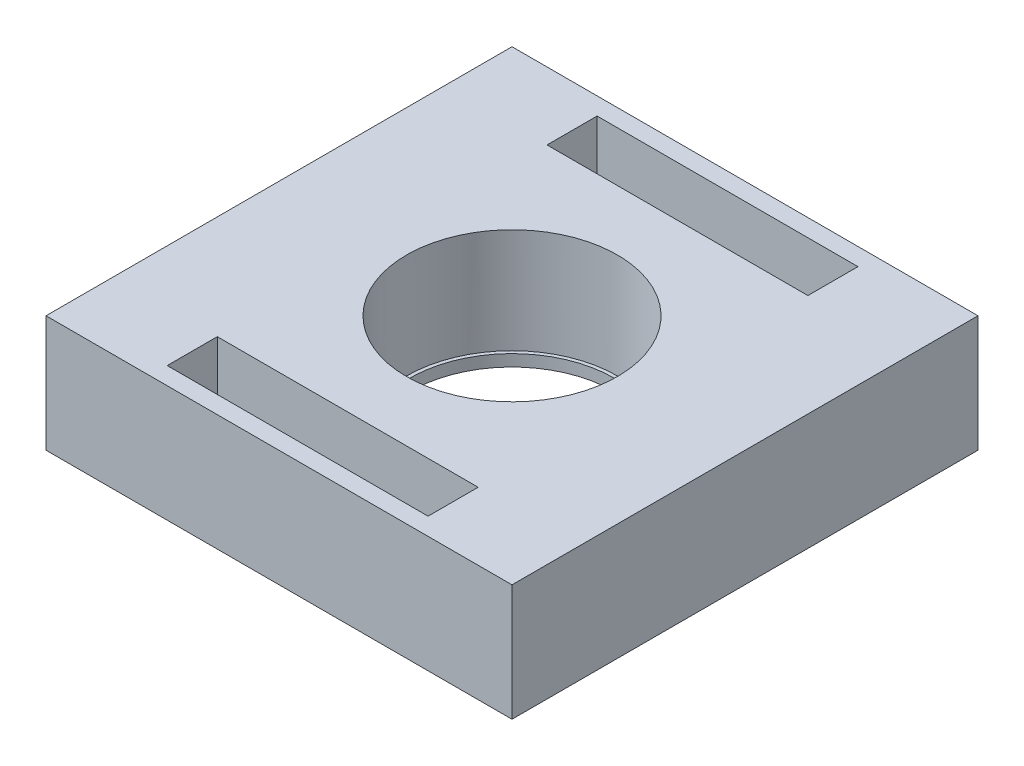
from build123d import *

# Parameters (mm, degrees)
SKETCH1_W           = 40.015172748
SKETCH1_H           = 40.015172748
BOSS_EXTRUDE1_DEPTH = 10
SKETCH2_R           = 8.75
CUT_EXTRUDE1_DEPTH  = 31.010115378
SKETCH3_W           = 22.4
SKETCH3_H           = 4.3
CUT_EXTRUDE3_DEPTH  = 6.7
SKETCH3_5_R         = 9.05
CUT_EXTRUDE4_DEPTH  = 9


with BuildPart() as part:
    # Sketch1 → Boss-Extrude1 (new body)
    with BuildSketch(Plane(origin=(0, 0, 0), x_dir=(1, 0, 0), z_dir=(0, 1, 0))):
        Rectangle(SKETCH1_W, SKETCH1_H)
    extrude(amount=-BOSS_EXTRUDE1_DEPTH)

    # Sketch2 → Cut-Extrude1 (cut, through all)
    with BuildSketch(Plane(origin=(0, 0, 0), x_dir=(1, 0, 0), z_dir=(0, 1, 0))):
        with Locations(Location((0, 0, 0), (0, 0, 270))):
            Circle(SKETCH2_R)
    extrude(amount=-CUT_EXTRUDE1_DEPTH, mode=Mode.SUBTRACT)

    # Sketch3 → Cut-Extrude3 (cut)
    with BuildSketch(Plane(origin=(0, 0, 0), x_dir=(1, 0, 0), z_dir=(0, 1, 0))):
        Polygon((11.2, 18.507586374), (0, 18.507586374), (-11.2, 18.507586374), (-11.2, 14.207586374), (0, 14.207586374), (11.2, 14.207586374), align=None)
        with Locations((0.1, -16.357586374)):
            Rectangle(SKETCH3_W, SKETCH3_H)
    extrude(amount=-CUT_EXTRUDE3_DEPTH, mode=Mode.SUBTRACT)

    # Sketch3<5> → Cut-Extrude4 (cut)
    with BuildSketch(Plane(origin=(0, 0, 0), x_dir=(1, 0, 0), z_dir=(0, 1, 0))):
        with Locations(Location((0, 0, 0), (0, 0, 270))):
            Circle(SKETCH3_5_R)
    extrude(amount=-CUT_EXTRUDE4_DEPTH, mode=Mode.SUBTRACT)


solid = part.part
